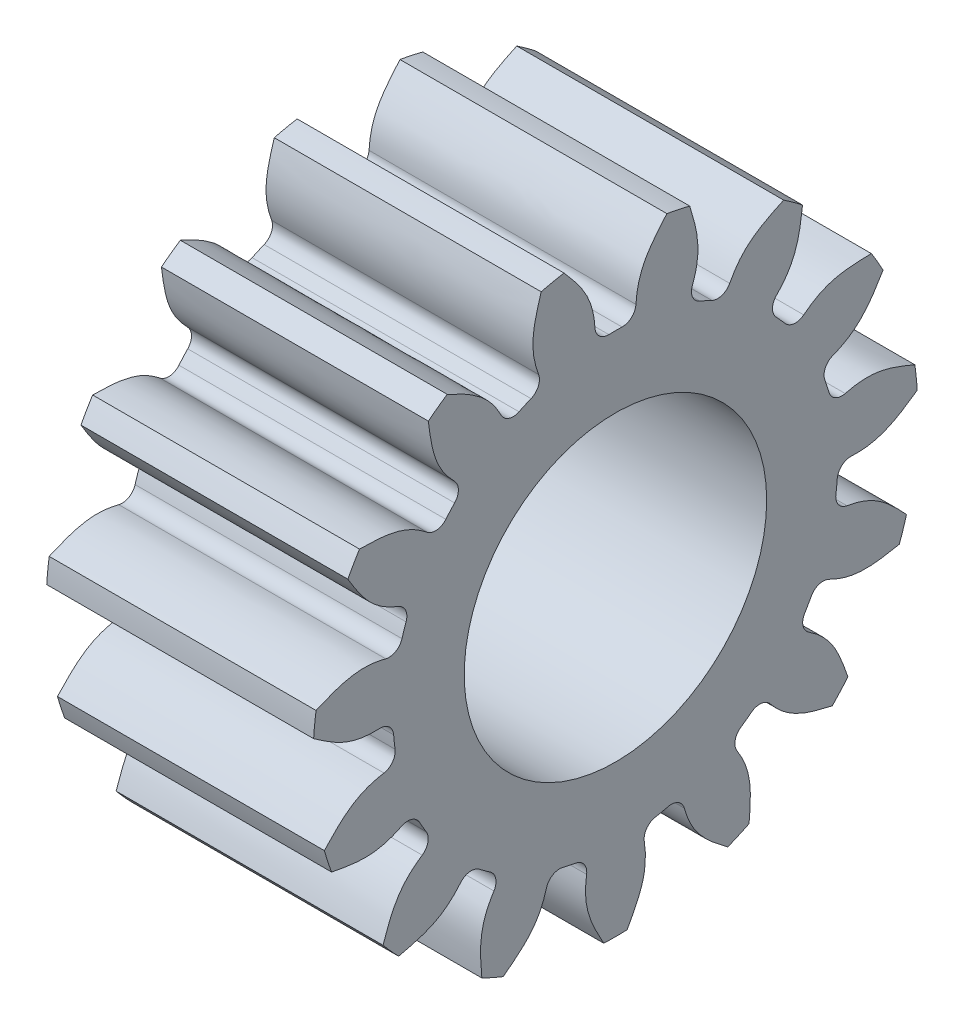
from build123d import *

# Parameters (mm, degrees)
ESQUISSE2_R                        = 17
EXTRUSION1_DEPTH                   = 15
EXTRUSION2_DEPTH                   = 29.337254631
CONG_1_R                           = 0.76
R_P_TITION_CIRCULAIRE1_COUNT       = 15
CONG_1_OF_R_P_TITION_CIRCULAIRE1_R = 0.76
ESQUISSE7_R                        = 8.5
EXTRUSION3_DEPTH                   = 29.314992936


with BuildPart() as part:
    # Esquisse2 → Extrusion1 (new body)
    with BuildSketch(Plane(origin=(0, 0, 0), x_dir=(0, 0, -1), z_dir=(1, 0, 0))):
        Circle(ESQUISSE2_R)
    extrude(amount=-EXTRUSION1_DEPTH)

    # Esquisse6 → Extrusion2 (cut, through all)
    with BuildSketch(Plane(origin=(0, 0, 0), x_dir=(0, 0, -1), z_dir=(1, 0, 0))):
        with BuildLine():
            ThreePointArc((1.121183327, 12.449616378), (0, 12.5), (-1.121183327, 12.449616378))
            add(Edge.make_bspline(
                [(-2.889975107, 16.752553354), (-2.390406069, 16.175160459), (-1.685345417, 15.360264058), (-1.155625166, 13.831666478), (-1.134517061, 12.984660078), (-1.121183327, 12.449616378)],
                knots=[0, 0, 0, 0, 0.472407051, 0.666725914, 1, 1, 1, 1], degree=3))
            ThreePointArc((-2.889975107, 16.752553354), (0, 17), (2.889975107, 16.752553354))
            add(Edge.make_bspline(
                [(2.889975107, 16.752553354), (2.390406069, 16.175160459), (1.685345417, 15.360264058), (1.155625166, 13.831666478), (1.134517061, 12.984660078), (1.121183327, 12.449616378)],
                knots=[0, 0, 0, 0, 0.472407051, 0.666725914, 1, 1, 1, 1], degree=3))
        make_face()
    extrusion2 = extrude(amount=-EXTRUSION2_DEPTH, mode=Mode.SUBTRACT)

    # Congé1
    cong_1_edges = [part.edges().sort_by_distance(p)[0] for p in [
        (-7.5, 12.449616378, -1.121183327),
        (-7.5, 12.449616378, 1.121183327),
    ]]
    fillet(cong_1_edges, radius=CONG_1_R)

    # Répétition circulaire1: Extrusion2 ×15 about axis
    r_p_tition_circulaire1_axis = Axis((-15, 0, 0), (1, 0, 0))
    for i in range(1, R_P_TITION_CIRCULAIRE1_COUNT):
        add(extrusion2.rotate(r_p_tition_circulaire1_axis, i * 360 / R_P_TITION_CIRCULAIRE1_COUNT), mode=Mode.SUBTRACT)

    # Congé1 of Répétition circulaire1
    cong_1_of_r_p_tition_circulaire1_edges = [part.edges().sort_by_distance(p)[0] for p in [
        (-7.5, 11.829316834, 4.039463237),
        (-7.5, 10.917264148, 6.087967109),
        (-7.5, 9.163620944, 8.501649911),
        (-7.5, 7.497217768, 10.00208607),
        (-7.5, 4.913451743, 11.493824079),
        (-7.5, 2.780834325, 12.186753483),
        (-7.5, -0.186297901, 12.498611647),
        (-7.5, -2.416380636, 12.264220506),
        (-7.5, -5.253834945, 11.342275714),
        (-7.5, -7.195781432, 10.221092387),
        (-7.5, -9.412936198, 8.224757269),
        (-7.5, -10.730966248, 6.410644538),
        (-7.5, -11.944455268, 3.685103572),
        (-7.5, -12.410669511, 1.49173801),
        (-7.5, -12.410669511, -1.49173801),
        (-7.5, -11.944455268, -3.685103572),
        (-7.5, -10.730966248, -6.410644538),
        (-7.5, -9.412936198, -8.224757269),
        (-7.5, -7.195781432, -10.221092387),
        (-7.5, -5.253834945, -11.342275714),
        (-7.5, -2.416380636, -12.264220506),
        (-7.5, -0.186297901, -12.498611647),
        (-7.5, 2.780834325, -12.186753483),
        (-7.5, 4.913451743, -11.493824079),
        (-7.5, 7.497217768, -10.00208607),
        (-7.5, 9.163620944, -8.501649911),
        (-7.5, 10.917264148, -6.087967109),
        (-7.5, 11.829316834, -4.039463237),
    ]]
    fillet(cong_1_of_r_p_tition_circulaire1_edges, radius=CONG_1_OF_R_P_TITION_CIRCULAIRE1_R)

    # Esquisse7 → Extrusion3 (cut, through all)
    with BuildSketch(Plane(origin=(0, 0, 0), x_dir=(0, 0, -1), z_dir=(1, 0, 0))):
        Circle(ESQUISSE7_R)
    extrude(amount=-EXTRUSION3_DEPTH, mode=Mode.SUBTRACT)


solid = part.part
